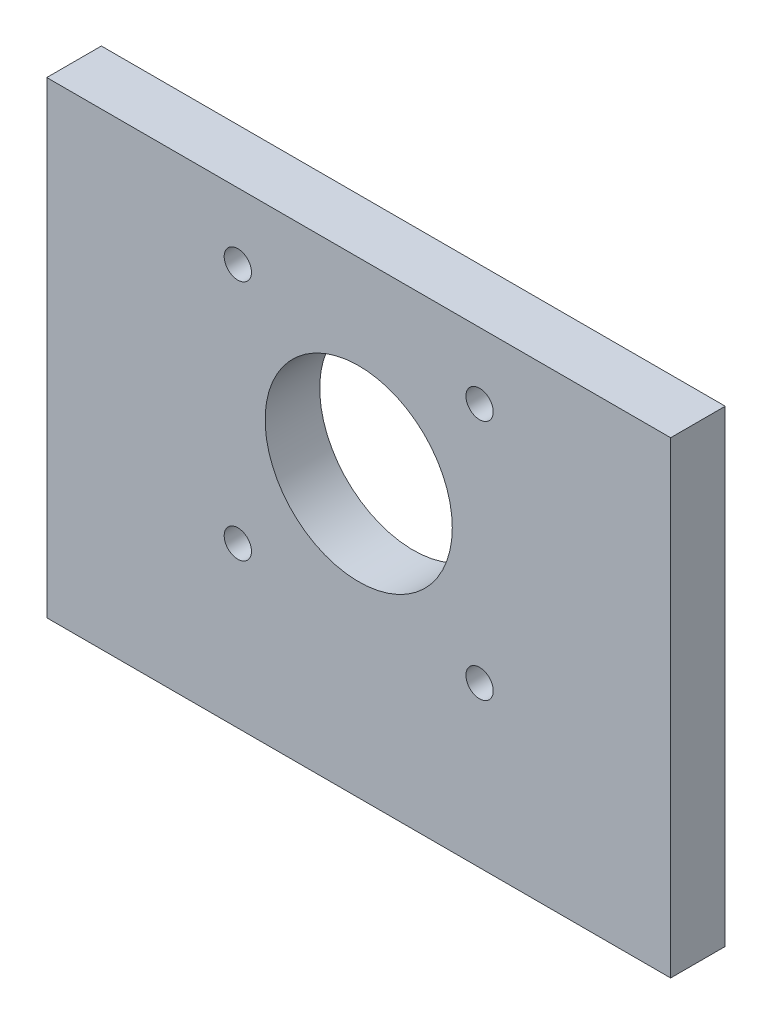
from build123d import *

# Parameters (mm, degrees)
Z_MOTOR_MOUNT_W   = 80
Z_MOTOR_MOUNT_H   = 60
Z_MOTOR_MOUNT_R   = 12
Z_MOTOR_MOUNT_R_2 = 1.75
F_7MM_DEPTH       = 7


with BuildPart() as part:
    # 外形与孔位_z_motor_mount → 板厚_7mm (new body)
    with BuildSketch(Plane.XY):
        with Locations((40, 30)):
            Rectangle(Z_MOTOR_MOUNT_W, Z_MOTOR_MOUNT_H)
        with Locations((40, 36)):
            Circle(Z_MOTOR_MOUNT_R, mode=Mode.SUBTRACT)
        with Locations((24.5, 20.5)):
            Circle(Z_MOTOR_MOUNT_R_2, mode=Mode.SUBTRACT)
        with Locations((24.5, 51.5)):
            Circle(Z_MOTOR_MOUNT_R_2, mode=Mode.SUBTRACT)
        with Locations((55.5, 20.5)):
            Circle(Z_MOTOR_MOUNT_R_2, mode=Mode.SUBTRACT)
        with Locations((55.5, 51.5)):
            Circle(Z_MOTOR_MOUNT_R_2, mode=Mode.SUBTRACT)
    extrude(amount=F_7MM_DEPTH)


solid = part.part
